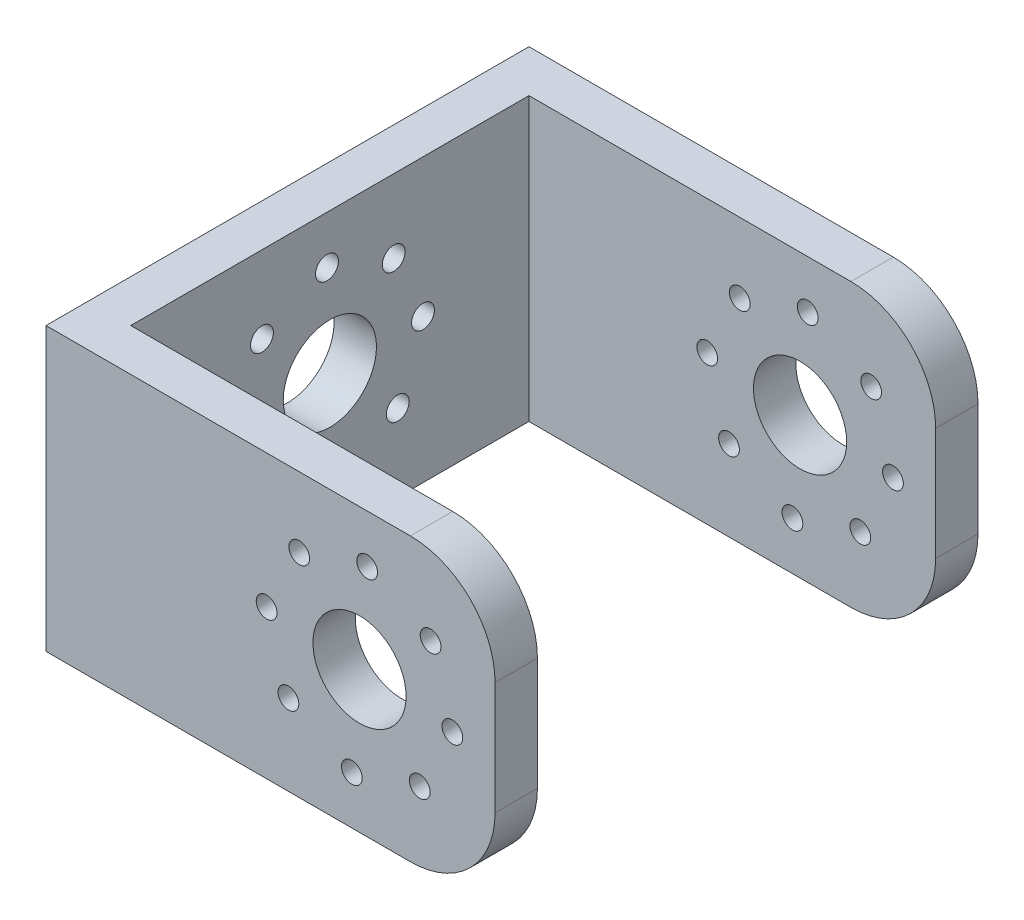
from build123d import *

# Parameters (mm, degrees)
BOSS_EXTRUDE1_DEPTH            = 33.31
CUT_EXTRUDE1_DEPTH             = 85.661420376
CUT_EXTRUDE1_DEPTH_BACK        = 85.661420376
SKETCH2_R                      = 5.5
FILLET1_R                      = 10
CUT_EXTRUDE2_REACH             = 86.661
SKETCH3_R                      = 5.5
CUT_EXTRUDE3_DEPTH             = 82.379088837
CUT_EXTRUDE3_DEPTH_BACK        = 82.379088837
SKETCH4_R                      = 1.225
CUT_EXTRUDE4_REACH             = 86.661
SKETCH6_R                      = 1.35
CUT_EXTRUDE4_DIRECTION_2_DEPTH = 85.661420376


with BuildPart() as part:
    # Sketch1 → Boss-Extrude1 (new body)
    with BuildSketch(Plane(origin=(0, 0, 0), x_dir=(1, 0, 0), z_dir=(0, 1, 0))):
        Polygon((0, 57), (0, 0), (53, 0), (53, 5), (5, 5), (5, 52), (53, 52), (53, 57), align=None)
    extrude(amount=BOSS_EXTRUDE1_DEPTH)

    # Sketch2 → Cut-Extrude1 (cut, two sides: drawn at the far end of the back side and taken through both)
    with BuildSketch(Plane.XY.offset(-CUT_EXTRUDE1_DEPTH_BACK)):
        with Locations((37, 16.655)):
            Circle(SKETCH2_R)
    extrude(amount=CUT_EXTRUDE1_DEPTH + CUT_EXTRUDE1_DEPTH_BACK, mode=Mode.SUBTRACT)

    # Fillet1
    fillet1_edges = [part.edges().sort_by_distance(p)[0] for p in [
        (53, 0, -54.5),
        (53, 33.31, -54.5),
        (53, 33.31, -2.5),
        (53, 0, -2.5),
    ]]
    fillet(fillet1_edges, radius=FILLET1_R)

    # Sketch3 → Cut-Extrude2 (cut, up to next)
    with BuildSketch(Plane.ZY, mode=Mode.PRIVATE) as cut_extrude2_sk1:
        with Locations((-28.5, 16.655)):
            Circle(SKETCH3_R)
    cut_extrude2_tool1 = extrude(cut_extrude2_sk1.sketch, amount=-CUT_EXTRUDE2_REACH, mode=Mode.PRIVATE) & part.part
    add(cut_extrude2_tool1.solids().sort_by_distance((0, 16.655, -28.5))[0], mode=Mode.SUBTRACT)

    # Sketch4 → Cut-Extrude3 (cut, two sides: drawn at the far end of the back side and taken through both)
    with BuildSketch(Plane(origin=(0, 0, -5), x_dir=(-1, 0, 0), z_dir=(0, 0, -1)).offset(-CUT_EXTRUDE3_DEPTH_BACK)):
        with Locations((-37.902229443, 27.617936743)):
            Circle(SKETCH4_R)
        with Locations((-29.886005644, 25.04493947)):
            Circle(SKETCH4_R)
        with Locations((-26.037063257, 17.557229443)):
            Circle(SKETCH4_R)
        with Locations((-28.61006053, 9.541005644)):
            Circle(SKETCH4_R)
        with Locations((-36.097770557, 5.692063257)):
            Circle(SKETCH4_R)
        with Locations((-44.113994356, 8.26506053)):
            Circle(SKETCH4_R)
        with Locations((-47.962936743, 15.752770557)):
            Circle(SKETCH4_R)
        with Locations((-45.38993947, 23.768994356)):
            Circle(SKETCH4_R)
    extrude(amount=CUT_EXTRUDE3_DEPTH + CUT_EXTRUDE3_DEPTH_BACK, mode=Mode.SUBTRACT)

    # Sketch6 → Cut-Extrude4 (cut, up to next)
    with BuildSketch(Plane.ZY, mode=Mode.PRIVATE) as cut_extrude4_sk1:
        with Locations(Location((-20.963129564, 8.642785323, 0), (0, 0, 180))):
            Circle(SKETCH6_R)
    cut_extrude4_tool1 = extrude(cut_extrude4_sk1.sketch, amount=-CUT_EXTRUDE4_REACH, mode=Mode.PRIVATE) & part.part
    # Sketch6 → Cut-Extrude4 (cut, up to next)
    with BuildSketch(Plane.ZY, mode=Mode.PRIVATE) as cut_extrude4_sk2:
        with Locations(Location((-28.836119137, 5.660136475, 0), (0, 0, 180))):
            Circle(SKETCH6_R)
    cut_extrude4_tool2 = extrude(cut_extrude4_sk2.sketch, amount=-CUT_EXTRUDE4_REACH, mode=Mode.PRIVATE) & part.part
    # Sketch6 → Cut-Extrude4 (cut, up to next)
    with BuildSketch(Plane.ZY, mode=Mode.PRIVATE) as cut_extrude4_sk3:
        with Locations(Location((-36.512214677, 9.118129564, 0), (0, 0, 180))):
            Circle(SKETCH6_R)
    cut_extrude4_tool3 = extrude(cut_extrude4_sk3.sketch, amount=-CUT_EXTRUDE4_REACH, mode=Mode.PRIVATE) & part.part
    # Sketch6 → Cut-Extrude4 (cut, up to next)
    with BuildSketch(Plane.ZY, mode=Mode.PRIVATE) as cut_extrude4_sk4:
        with Locations(Location((-39.494863525, 16.991119137, 0), (0, 0, 180))):
            Circle(SKETCH6_R)
    cut_extrude4_tool4 = extrude(cut_extrude4_sk4.sketch, amount=-CUT_EXTRUDE4_REACH, mode=Mode.PRIVATE) & part.part
    # Sketch6 → Cut-Extrude4 (cut, up to next)
    with BuildSketch(Plane.ZY, mode=Mode.PRIVATE) as cut_extrude4_sk5:
        with Locations(Location((-36.036870436, 24.667214677, 0), (0, 0, 180))):
            Circle(SKETCH6_R)
    cut_extrude4_tool5 = extrude(cut_extrude4_sk5.sketch, amount=-CUT_EXTRUDE4_REACH, mode=Mode.PRIVATE) & part.part
    # Sketch6 → Cut-Extrude4 (cut, up to next)
    with BuildSketch(Plane.ZY, mode=Mode.PRIVATE) as cut_extrude4_sk6:
        with Locations(Location((-28.163880863, 27.649863525, 0), (0, 0, 180))):
            Circle(SKETCH6_R)
    cut_extrude4_tool6 = extrude(cut_extrude4_sk6.sketch, amount=-CUT_EXTRUDE4_REACH, mode=Mode.PRIVATE) & part.part
    # Sketch6 → Cut-Extrude4 (cut, up to next)
    with BuildSketch(Plane.ZY, mode=Mode.PRIVATE) as cut_extrude4_sk7:
        with Locations(Location((-20.487785323, 24.191870436, 0), (0, 0, 180))):
            Circle(SKETCH6_R)
    cut_extrude4_tool7 = extrude(cut_extrude4_sk7.sketch, amount=-CUT_EXTRUDE4_REACH, mode=Mode.PRIVATE) & part.part
    # Sketch6 → Cut-Extrude4 (cut, up to next)
    with BuildSketch(Plane.ZY, mode=Mode.PRIVATE) as cut_extrude4_sk8:
        with Locations(Location((-17.505136475, 16.318880863, 0), (0, 0, 180))):
            Circle(SKETCH6_R)
    cut_extrude4_tool8 = extrude(cut_extrude4_sk8.sketch, amount=-CUT_EXTRUDE4_REACH, mode=Mode.PRIVATE) & part.part
    add(cut_extrude4_tool1.solids().sort_by_distance((0, 8.642785, -20.96313))[0], mode=Mode.SUBTRACT)
    add(cut_extrude4_tool2.solids().sort_by_distance((0, 5.660136, -28.836119))[0], mode=Mode.SUBTRACT)
    add(cut_extrude4_tool3.solids().sort_by_distance((0, 9.11813, -36.512215))[0], mode=Mode.SUBTRACT)
    add(cut_extrude4_tool4.solids().sort_by_distance((0, 16.991119, -39.494864))[0], mode=Mode.SUBTRACT)
    add(cut_extrude4_tool5.solids().sort_by_distance((0, 24.667215, -36.03687))[0], mode=Mode.SUBTRACT)
    add(cut_extrude4_tool6.solids().sort_by_distance((0, 27.649864, -28.163881))[0], mode=Mode.SUBTRACT)
    add(cut_extrude4_tool7.solids().sort_by_distance((0, 24.19187, -20.487785))[0], mode=Mode.SUBTRACT)
    add(cut_extrude4_tool8.solids().sort_by_distance((0, 16.318881, -17.505136))[0], mode=Mode.SUBTRACT)

    # Sketch6 → Cut-Extrude4 direction 2 (cut)
    with BuildSketch(Plane.ZY):
        with Locations(Location((-20.963129564, 8.642785323, 0), (0, 0, 180))):
            Circle(SKETCH6_R)
        with Locations(Location((-28.836119137, 5.660136475, 0), (0, 0, 180))):
            Circle(SKETCH6_R)
        with Locations(Location((-36.512214677, 9.118129564, 0), (0, 0, 180))):
            Circle(SKETCH6_R)
        with Locations(Location((-39.494863525, 16.991119137, 0), (0, 0, 180))):
            Circle(SKETCH6_R)
        with Locations(Location((-36.036870436, 24.667214677, 0), (0, 0, 180))):
            Circle(SKETCH6_R)
        with Locations(Location((-28.163880863, 27.649863525, 0), (0, 0, 180))):
            Circle(SKETCH6_R)
        with Locations(Location((-20.487785323, 24.191870436, 0), (0, 0, 180))):
            Circle(SKETCH6_R)
        with Locations(Location((-17.505136475, 16.318880863, 0), (0, 0, 180))):
            Circle(SKETCH6_R)
    extrude(amount=CUT_EXTRUDE4_DIRECTION_2_DEPTH, mode=Mode.SUBTRACT)


solid = part.part
